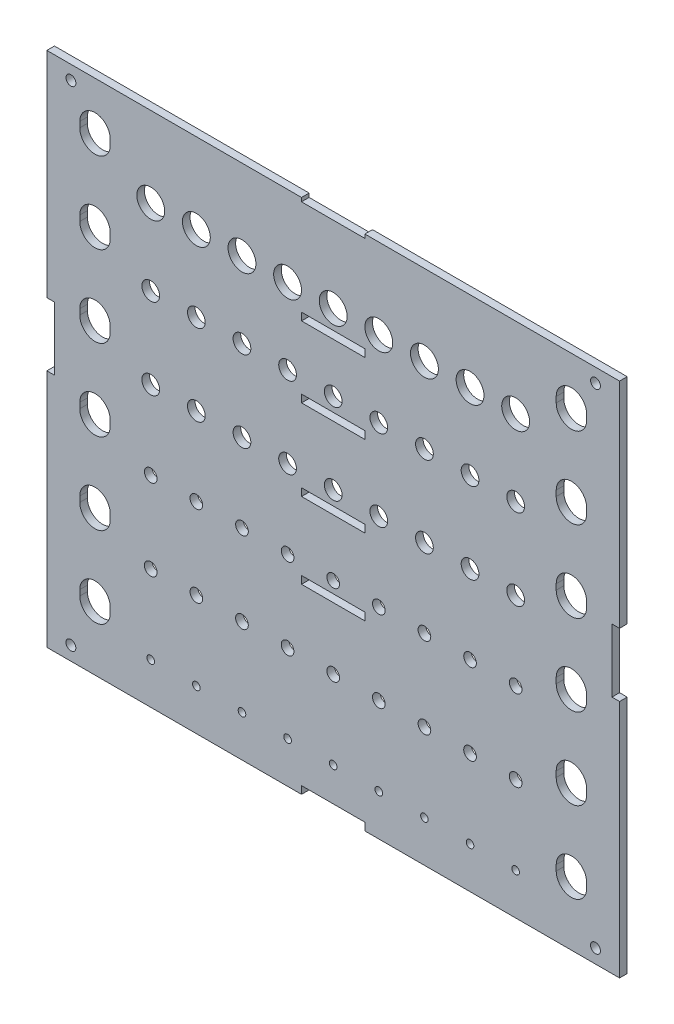
from build123d import *

# Parameters (mm, degrees)
SKETCH_1_W          = 230
SKETCH_1_H          = 230
SKETCH_1_R          = 1.95
SKETCH_1_R_2        = 5.5
SKETCH_1_R_3        = 3.5
SKETCH_1_R_4        = 2.5
SKETCH_1_R_5        = 1.5
EXTRUDE_1_DEPTH     = 3
SKETCH_2_W          = 25
SKETCH_2_H          = 3
SKETCH_2_W_2        = 3
SKETCH_2_H_2        = 25
SKETCH_2_H_3        = 1.5
CUT_EXTRUDE_1_DEPTH = 10


with BuildPart() as part:
    # Эскиз1 → Бобышка-Вытянуть1 (new body)
    with BuildSketch(Plane.XY):
        with Locations((-16.903614458, -2.811401708)):
            Rectangle(SKETCH_1_W, SKETCH_1_H)
        with Locations((-120.403614458, 93.688598292)):
            Circle(SKETCH_1_R, mode=Mode.SUBTRACT)
        with Locations((86.596385542, 93.688598292)):
            Circle(SKETCH_1_R, mode=Mode.SUBTRACT)
        with Locations((86.596385542, -99.311401708)):
            Circle(SKETCH_1_R, mode=Mode.SUBTRACT)
        with Locations((-120.403614458, -99.311401708)):
            Circle(SKETCH_1_R, mode=Mode.SUBTRACT)
        with Locations((-88.903614458, 67.488598292)):
            Circle(SKETCH_1_R_2, mode=Mode.SUBTRACT)
        with Locations((-88.903614458, 5.488598292)):
            Circle(SKETCH_1_R_3, mode=Mode.SUBTRACT)
        with Locations((-88.903614458, -57.511401708)):
            Circle(SKETCH_1_R_4, mode=Mode.SUBTRACT)
        with Locations((-88.903614458, -88.511401708)):
            Circle(SKETCH_1_R_5, mode=Mode.SUBTRACT)
        with Locations((-88.903614458, 37.488598292)):
            Circle(SKETCH_1_R_3, mode=Mode.SUBTRACT)
        with Locations((-88.903614458, -25.511401708)):
            Circle(SKETCH_1_R_4, mode=Mode.SUBTRACT)
        with Locations((-70.903614458, 67.488598292)):
            Circle(SKETCH_1_R_2, mode=Mode.SUBTRACT)
        with Locations((-70.903614458, 5.488598292)):
            Circle(SKETCH_1_R_3, mode=Mode.SUBTRACT)
        with Locations((-70.903614458, -57.511401708)):
            Circle(SKETCH_1_R_4, mode=Mode.SUBTRACT)
        with Locations((-70.903614458, -88.511401708)):
            Circle(SKETCH_1_R_5, mode=Mode.SUBTRACT)
        with Locations((-70.903614458, 37.488598292)):
            Circle(SKETCH_1_R_3, mode=Mode.SUBTRACT)
        with Locations((-70.903614458, -25.511401708)):
            Circle(SKETCH_1_R_4, mode=Mode.SUBTRACT)
        with Locations((-52.903614458, 67.488598292)):
            Circle(SKETCH_1_R_2, mode=Mode.SUBTRACT)
        with Locations((-52.903614458, 5.488598292)):
            Circle(SKETCH_1_R_3, mode=Mode.SUBTRACT)
        with Locations((-52.903614458, -57.511401708)):
            Circle(SKETCH_1_R_4, mode=Mode.SUBTRACT)
        with Locations((-52.903614458, -88.511401708)):
            Circle(SKETCH_1_R_5, mode=Mode.SUBTRACT)
        with Locations((-52.903614458, 37.488598292)):
            Circle(SKETCH_1_R_3, mode=Mode.SUBTRACT)
        with Locations((-52.903614458, -25.511401708)):
            Circle(SKETCH_1_R_4, mode=Mode.SUBTRACT)
        with Locations((-34.903614458, 67.488598292)):
            Circle(SKETCH_1_R_2, mode=Mode.SUBTRACT)
        with Locations((-34.903614458, 5.488598292)):
            Circle(SKETCH_1_R_3, mode=Mode.SUBTRACT)
        with Locations((-34.903614458, -57.511401708)):
            Circle(SKETCH_1_R_4, mode=Mode.SUBTRACT)
        with Locations((-34.903614458, -88.511401708)):
            Circle(SKETCH_1_R_5, mode=Mode.SUBTRACT)
        with Locations((-34.903614458, 37.488598292)):
            Circle(SKETCH_1_R_3, mode=Mode.SUBTRACT)
        with Locations((-34.903614458, -25.511401708)):
            Circle(SKETCH_1_R_4, mode=Mode.SUBTRACT)
        with Locations((-16.903614458, 67.488598292)):
            Circle(SKETCH_1_R_2, mode=Mode.SUBTRACT)
        with Locations((-16.903614458, 5.488598292)):
            Circle(SKETCH_1_R_3, mode=Mode.SUBTRACT)
        with Locations((-16.903614458, -57.511401708)):
            Circle(SKETCH_1_R_4, mode=Mode.SUBTRACT)
        with Locations((-16.903614458, -88.511401708)):
            Circle(SKETCH_1_R_5, mode=Mode.SUBTRACT)
        with Locations((-16.903614458, 37.488598292)):
            Circle(SKETCH_1_R_3, mode=Mode.SUBTRACT)
        with Locations((-16.903614458, -25.511401708)):
            Circle(SKETCH_1_R_4, mode=Mode.SUBTRACT)
        with Locations((1.096385542, 67.488598292)):
            Circle(SKETCH_1_R_2, mode=Mode.SUBTRACT)
        with Locations((1.096385542, 5.488598292)):
            Circle(SKETCH_1_R_3, mode=Mode.SUBTRACT)
        with Locations((1.096385542, -57.511401708)):
            Circle(SKETCH_1_R_4, mode=Mode.SUBTRACT)
        with Locations((1.096385542, -88.511401708)):
            Circle(SKETCH_1_R_5, mode=Mode.SUBTRACT)
        with Locations((1.096385542, 37.488598292)):
            Circle(SKETCH_1_R_3, mode=Mode.SUBTRACT)
        with Locations((1.096385542, -25.511401708)):
            Circle(SKETCH_1_R_4, mode=Mode.SUBTRACT)
        with Locations((19.096385542, 67.488598292)):
            Circle(SKETCH_1_R_2, mode=Mode.SUBTRACT)
        with Locations((19.096385542, 5.488598292)):
            Circle(SKETCH_1_R_3, mode=Mode.SUBTRACT)
        with Locations((19.096385542, -57.511401708)):
            Circle(SKETCH_1_R_4, mode=Mode.SUBTRACT)
        with Locations((19.096385542, -88.511401708)):
            Circle(SKETCH_1_R_5, mode=Mode.SUBTRACT)
        with Locations((19.096385542, 37.488598292)):
            Circle(SKETCH_1_R_3, mode=Mode.SUBTRACT)
        with Locations((19.096385542, -25.511401708)):
            Circle(SKETCH_1_R_4, mode=Mode.SUBTRACT)
        with Locations((37.096385542, 67.488598292)):
            Circle(SKETCH_1_R_2, mode=Mode.SUBTRACT)
        with Locations((37.096385542, 5.488598292)):
            Circle(SKETCH_1_R_3, mode=Mode.SUBTRACT)
        with Locations((37.096385542, -57.511401708)):
            Circle(SKETCH_1_R_4, mode=Mode.SUBTRACT)
        with Locations((37.096385542, -88.511401708)):
            Circle(SKETCH_1_R_5, mode=Mode.SUBTRACT)
        with Locations((37.096385542, 37.488598292)):
            Circle(SKETCH_1_R_3, mode=Mode.SUBTRACT)
        with Locations((37.096385542, -25.511401708)):
            Circle(SKETCH_1_R_4, mode=Mode.SUBTRACT)
        with Locations((55.096385542, 67.488598292)):
            Circle(SKETCH_1_R_2, mode=Mode.SUBTRACT)
        with Locations((55.096385542, 5.488598292)):
            Circle(SKETCH_1_R_3, mode=Mode.SUBTRACT)
        with Locations((55.096385542, -57.511401708)):
            Circle(SKETCH_1_R_4, mode=Mode.SUBTRACT)
        with Locations((55.096385542, -88.511401708)):
            Circle(SKETCH_1_R_5, mode=Mode.SUBTRACT)
        with Locations((55.096385542, 37.488598292)):
            Circle(SKETCH_1_R_3, mode=Mode.SUBTRACT)
        with Locations((55.096385542, -25.511401708)):
            Circle(SKETCH_1_R_4, mode=Mode.SUBTRACT)
        with BuildLine():
            Line((83.096385542, 81.428915663), (83.096385542, 79.228915663))
            ThreePointArc((83.096385542, 79.228915663), (77.096385542, 73.228915663), (71.096385542, 79.228915663))
            Line((71.096385542, 79.228915663), (71.096385542, 81.428915663))
            ThreePointArc((71.096385542, 81.428915663), (77.096385542, 87.428915663), (83.096385542, 81.428915663))
        make_face(mode=Mode.SUBTRACT)
        with BuildLine():
            Line((-104.903614458, 81.428915663), (-104.903614458, 79.228915663))
            ThreePointArc((-104.903614458, 79.228915663), (-110.903614458, 73.228915663), (-116.903614458, 79.228915663))
            Line((-116.903614458, 79.228915663), (-116.903614458, 81.428915663))
            ThreePointArc((-116.903614458, 81.428915663), (-110.903614458, 87.428915663), (-104.903614458, 81.428915663))
        make_face(mode=Mode.SUBTRACT)
        with BuildLine():
            Line((83.096385542, 49.428915663), (83.096385542, 47.228915663))
            ThreePointArc((83.096385542, 47.228915663), (77.096385542, 41.228915663), (71.096385542, 47.228915663))
            Line((71.096385542, 47.228915663), (71.096385542, 49.428915663))
            ThreePointArc((71.096385542, 49.428915663), (77.096385542, 55.428915663), (83.096385542, 49.428915663))
        make_face(mode=Mode.SUBTRACT)
        with BuildLine():
            Line((-104.903614458, 49.428915663), (-104.903614458, 47.228915663))
            ThreePointArc((-104.903614458, 47.228915663), (-110.903614458, 41.228915663), (-116.903614458, 47.228915663))
            Line((-116.903614458, 47.228915663), (-116.903614458, 49.428915663))
            ThreePointArc((-116.903614458, 49.428915663), (-110.903614458, 55.428915663), (-104.903614458, 49.428915663))
        make_face(mode=Mode.SUBTRACT)
        with BuildLine():
            Line((83.096385542, 17.428915663), (83.096385542, 15.228915663))
            ThreePointArc((83.096385542, 15.228915663), (77.096385542, 9.228915663), (71.096385542, 15.228915663))
            Line((71.096385542, 15.228915663), (71.096385542, 17.428915663))
            ThreePointArc((71.096385542, 17.428915663), (77.096385542, 23.428915663), (83.096385542, 17.428915663))
        make_face(mode=Mode.SUBTRACT)
        with BuildLine():
            Line((-104.903614458, 17.428915663), (-104.903614458, 15.228915663))
            ThreePointArc((-104.903614458, 15.228915663), (-110.903614458, 9.228915663), (-116.903614458, 15.228915663))
            Line((-116.903614458, 15.228915663), (-116.903614458, 17.428915663))
            ThreePointArc((-116.903614458, 17.428915663), (-110.903614458, 23.428915663), (-104.903614458, 17.428915663))
        make_face(mode=Mode.SUBTRACT)
        with BuildLine():
            Line((83.096385542, -14.571084337), (83.096385542, -16.771084337))
            ThreePointArc((83.096385542, -16.771084337), (77.096385542, -22.771084337), (71.096385542, -16.771084337))
            Line((71.096385542, -16.771084337), (71.096385542, -14.571084337))
            ThreePointArc((71.096385542, -14.571084337), (77.096385542, -8.571084337), (83.096385542, -14.571084337))
        make_face(mode=Mode.SUBTRACT)
        with BuildLine():
            Line((-104.903614458, -14.571084337), (-104.903614458, -16.771084337))
            ThreePointArc((-104.903614458, -16.771084337), (-110.903614458, -22.771084337), (-116.903614458, -16.771084337))
            Line((-116.903614458, -16.771084337), (-116.903614458, -14.571084337))
            ThreePointArc((-116.903614458, -14.571084337), (-110.903614458, -8.571084337), (-104.903614458, -14.571084337))
        make_face(mode=Mode.SUBTRACT)
        with BuildLine():
            Line((83.096385542, -46.571084337), (83.096385542, -48.771084337))
            ThreePointArc((83.096385542, -48.771084337), (77.096385542, -54.771084337), (71.096385542, -48.771084337))
            Line((71.096385542, -48.771084337), (71.096385542, -46.571084337))
            ThreePointArc((71.096385542, -46.571084337), (77.096385542, -40.571084337), (83.096385542, -46.571084337))
        make_face(mode=Mode.SUBTRACT)
        with BuildLine():
            Line((-104.903614458, -46.571084337), (-104.903614458, -48.771084337))
            ThreePointArc((-104.903614458, -48.771084337), (-110.903614458, -54.771084337), (-116.903614458, -48.771084337))
            Line((-116.903614458, -48.771084337), (-116.903614458, -46.571084337))
            ThreePointArc((-116.903614458, -46.571084337), (-110.903614458, -40.571084337), (-104.903614458, -46.571084337))
        make_face(mode=Mode.SUBTRACT)
        with BuildLine():
            Line((83.096385542, -78.571084337), (83.096385542, -80.771084337))
            ThreePointArc((83.096385542, -80.771084337), (77.096385542, -86.771084337), (71.096385542, -80.771084337))
            Line((71.096385542, -80.771084337), (71.096385542, -78.571084337))
            ThreePointArc((71.096385542, -78.571084337), (77.096385542, -72.571084337), (83.096385542, -78.571084337))
        make_face(mode=Mode.SUBTRACT)
        with BuildLine():
            Line((-104.903614458, -78.571084337), (-104.903614458, -80.771084337))
            ThreePointArc((-104.903614458, -80.771084337), (-110.903614458, -86.771084337), (-116.903614458, -80.771084337))
            Line((-116.903614458, -80.771084337), (-116.903614458, -78.571084337))
            ThreePointArc((-116.903614458, -78.571084337), (-110.903614458, -72.571084337), (-104.903614458, -78.571084337))
        make_face(mode=Mode.SUBTRACT)
    extrude(amount=EXTRUDE_1_DEPTH)

    # Эскиз2 → Вырез-Вытянуть1 (cut)
    # profile 1 of 9: a face of its own
    with BuildSketch(Plane.XY.offset(3)):
        Polygon((-124.903614458, 112.188598292), (-131.903614458, 112.188598292), (-131.903614458, 99.188598292), (-131.903614458, -104.811401708), (-131.903614458, -117.811401708), (-124.903614458, -117.811401708), (91.096385542, -117.811401708), (98.096385542, -117.811401708), (98.096385542, -104.811401708), (98.096385542, 99.188598292), (98.096385542, 112.188598292), (91.096385542, 112.188598292), align=None)
        Polygon((-129.903614458, 14.688598292), (-129.903614458, 99.188598292), (-29.403614458, 99.188598292), (-4.403614458, 99.188598292), (96.096385542, 99.188598292), (96.096385542, 14.688598292), (96.096385542, -10.311401708), (96.096385542, -104.811401708), (-4.403614458, -104.811401708), (-29.403614458, -104.811401708), (-129.903614458, -104.811401708), (-129.903614458, -10.311401708), align=None, mode=Mode.SUBTRACT)
    # profile 2 of 9: a face of its own
    with BuildSketch(Plane.XY.offset(3)):
        with Locations((-16.903614458, 58.488598292)):
            Rectangle(SKETCH_2_W, SKETCH_2_H)
    # profile 3 of 9: a face of its own
    with BuildSketch(Plane.XY.offset(3)):
        with Locations((-16.903614458, -1.511401708)):
            Rectangle(SKETCH_2_W, SKETCH_2_H)
    # profile 4 of 9: a face of its own
    with BuildSketch(Plane.XY.offset(3)):
        with Locations((-128.403614458, 2.188598292)):
            Rectangle(SKETCH_2_W_2, SKETCH_2_H_2)
    # profile 5 of 9: a face of its own
    with BuildSketch(Plane.XY.offset(3)):
        with Locations((-16.903614458, 98.438598292)):
            Rectangle(SKETCH_2_W, SKETCH_2_H_3)
    # profile 6 of 9: a face of its own
    with BuildSketch(Plane.XY.offset(3)):
        with Locations((-16.903614458, 30.488598292)):
            Rectangle(SKETCH_2_W, SKETCH_2_H)
    # profile 7 of 9: a face of its own
    with BuildSketch(Plane.XY.offset(3)):
        with Locations((-16.903614458, -31.511401708)):
            Rectangle(SKETCH_2_W, SKETCH_2_H)
    # profile 8 of 9: a face of its own
    with BuildSketch(Plane.XY.offset(3)):
        with Locations((94.596385542, 2.188598292)):
            Rectangle(SKETCH_2_W_2, SKETCH_2_H_2)
    # profile 9 of 9: a face of its own
    with BuildSketch(Plane.XY.offset(3)):
        with Locations((-16.903614458, -103.311401708)):
            Rectangle(SKETCH_2_W, SKETCH_2_H)
    extrude(amount=-CUT_EXTRUDE_1_DEPTH, mode=Mode.SUBTRACT)


solid = part.part
